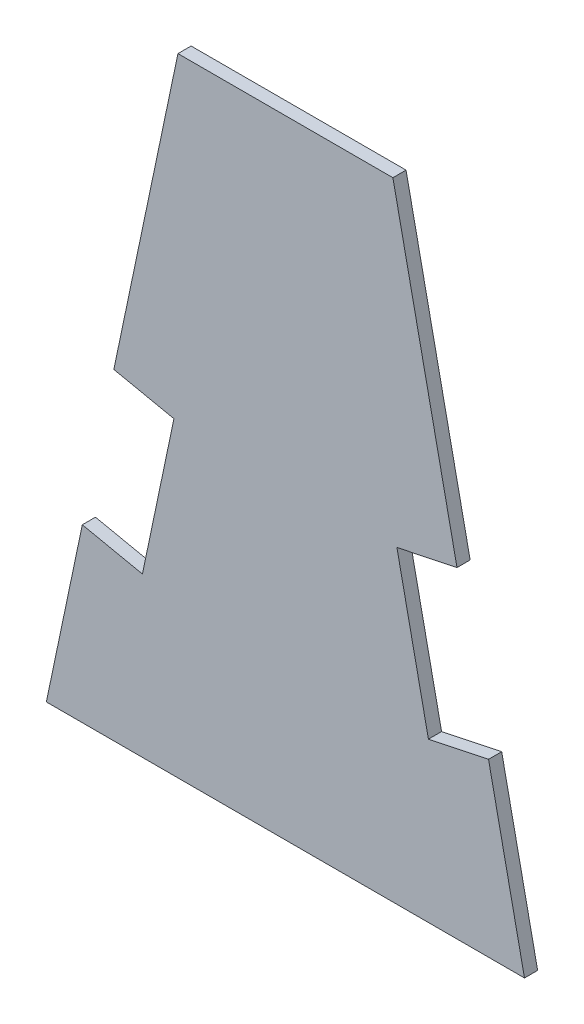
from build123d import *

# Parameters (mm, degrees)
BOSS_EXTRUDE1_DEPTH = 3


with BuildPart() as part:
    # Sketch1 → Boss-Extrude1 (new body)
    with BuildSketch(Plane.XY):
        Polygon((0, 0), (109, 0), (100.801549171, 39.079282286), (87.099822349, 36.204794142), (79.913601987, 70.459111197), (93.61532881, 73.333599341), (79, 143), (30, 143), (15.38467119, 73.333599341), (29.086398013, 70.459111197), (21.900177651, 36.204794142), (8.198450829, 39.079282286), align=None)
    extrude(amount=BOSS_EXTRUDE1_DEPTH)


solid = part.part
